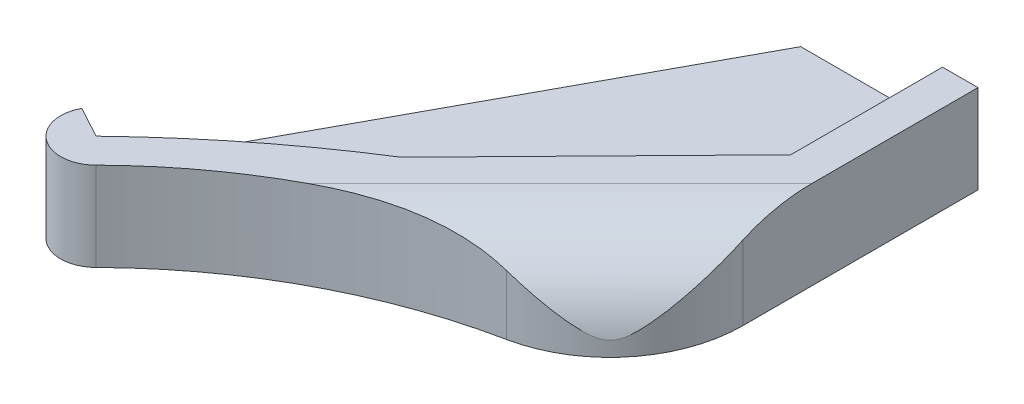
from build123d import *

# Parameters (mm, degrees)
BOSS_EXTRUDE1_DEPTH     = 6.35
FILLET1_R               = 9.525
CUT_EXTRUDE1_DEPTH      = 41.664797122
CUT_EXTRUDE1_DEPTH_BACK = 41.664797122
CUT_EXTRUDE2_DEPTH      = 3.81


with BuildPart() as part:
    # Sketch2 → Boss-Extrude1 (new body)
    with BuildSketch(Plane(origin=(0, 0, 0), x_dir=(1, 0, 0), z_dir=(0, 1, 0))):
        with BuildLine():
            Line((0, 0), (0, 25.4))
            Line((0, 25.4), (-12.7, 25.4))
            Line((-12.7, 25.4), (-30.807819057, -7.991432922))
            ThreePointArc((-30.807819057, -7.991432922), (-30.099929857, -11.233569232), (-26.7890625, -11.008375273))
            ThreePointArc((-26.7890625, -11.008375273), (-14.481351765, -2.859392016), (0, 0))
        make_face()
    extrude(amount=BOSS_EXTRUDE1_DEPTH)

    # Fillet1
    fillet1_edges = [part.edges().sort_by_distance(p)[0] for p in [
        (0, 3.175, 0),
    ]]
    fillet(fillet1_edges, radius=FILLET1_R)

    # Sketch3 → Cut-Extrude1 (cut, two sides: drawn at the far end of the back side and taken through both)
    with BuildSketch(Plane(origin=(0, 0, 0), x_dir=(-0.7071067811865489, 0, -0.7071067811865462), z_dir=(0.7071067811865462, 0, -0.7071067811865489)).offset(-CUT_EXTRUDE1_DEPTH_BACK)):
        with BuildLine():
            Line((9.525, 6.35), (9.525, 7.810784714))
            Line((9.525, 7.810784714), (2.20669647, 7.810784714))
            Line((2.20669647, 7.810784714), (2.20669647, 0))
            Line((2.20669647, 0), (3.175, 0))
            ThreePointArc((3.175, 0), (5.034871939, 4.490128061), (9.525, 6.35))
        make_face()
    extrude(amount=CUT_EXTRUDE1_DEPTH + CUT_EXTRUDE1_DEPTH_BACK, mode=Mode.SUBTRACT)

    # Sketch4 → Cut-Extrude2 (cut)
    with BuildSketch(Plane(origin=(0, 6.35, 0), x_dir=(1, 0, 0), z_dir=(0, 1, 0))):
        with BuildLine():
            Line((-16.337070041, 0.422049177), (-2.54, 14.52248663))
            Line((-2.54, 14.52248663), (-2.54, 25.4))
            Line((-2.54, 25.4), (-12.7, 25.4))
            Line((-12.7, 25.4), (-30.807819057, -7.991432922))
            Line((-30.807819057, -7.991432922), (-28.575, -9.202266957))
            ThreePointArc((-28.575, -9.202266957), (-22.702482164, -4.076735677), (-16.337070041, 0.422049177))
        make_face()
    extrude(amount=-CUT_EXTRUDE2_DEPTH, mode=Mode.SUBTRACT)


solid = part.part
